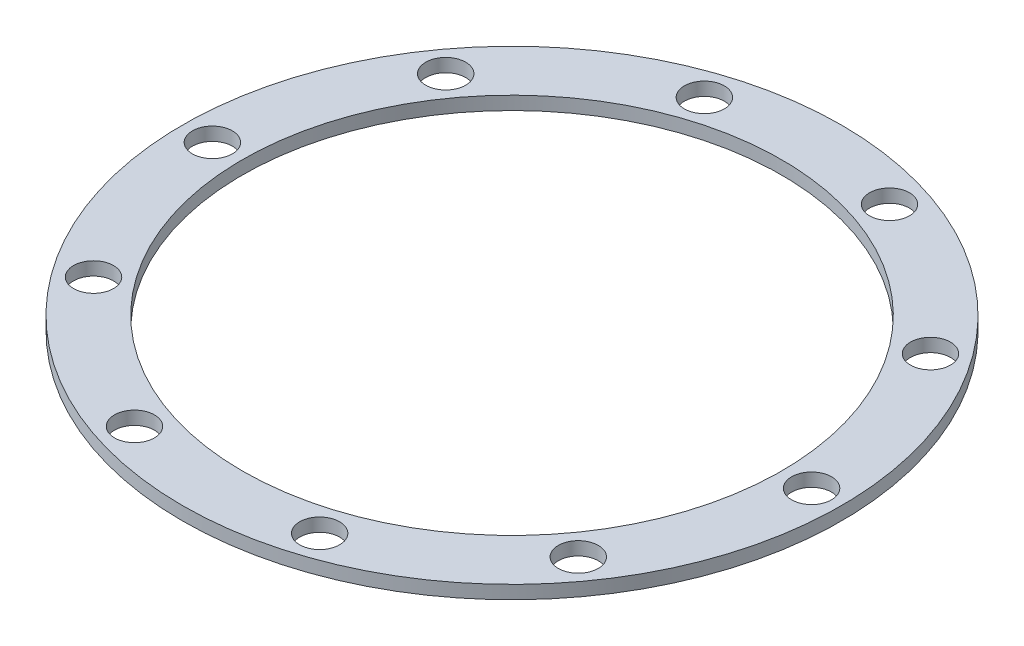
from build123d import *

# Parameters (mm, degrees)
SKETCH1_R           = 99
SKETCH1_R_2         = 6
SKETCH1_R_3         = 81
BOSS_EXTRUDE1_DEPTH = 2


with BuildPart() as part:
    # Sketch1 → Boss-Extrude1 (new, symmetric)
    with BuildSketch(Plane(origin=(0, 0, 0), x_dir=(1, 0, 0), z_dir=(0, 1, 0))):
        Circle(SKETCH1_R)
        with Locations((90, 0)):
            Circle(SKETCH1_R_2, mode=Mode.SUBTRACT)
        with Locations((72.811529494, -52.900672706)):
            Circle(SKETCH1_R_2, mode=Mode.SUBTRACT)
        with Locations((27.811529494, -85.595086467)):
            Circle(SKETCH1_R_2, mode=Mode.SUBTRACT)
        with Locations((-27.811529494, -85.595086467)):
            Circle(SKETCH1_R_2, mode=Mode.SUBTRACT)
        with Locations((-72.811529494, -52.900672706)):
            Circle(SKETCH1_R_2, mode=Mode.SUBTRACT)
        with Locations((-90, 0)):
            Circle(SKETCH1_R_2, mode=Mode.SUBTRACT)
        with Locations((-72.811529494, 52.900672706)):
            Circle(SKETCH1_R_2, mode=Mode.SUBTRACT)
        with Locations((-27.811529494, 85.595086467)):
            Circle(SKETCH1_R_2, mode=Mode.SUBTRACT)
        with Locations((27.811529494, 85.595086467)):
            Circle(SKETCH1_R_2, mode=Mode.SUBTRACT)
        with Locations((72.811529494, 52.900672706)):
            Circle(SKETCH1_R_2, mode=Mode.SUBTRACT)
        Circle(SKETCH1_R_3, mode=Mode.SUBTRACT)
    extrude(amount=BOSS_EXTRUDE1_DEPTH, both=True)


solid = part.part
